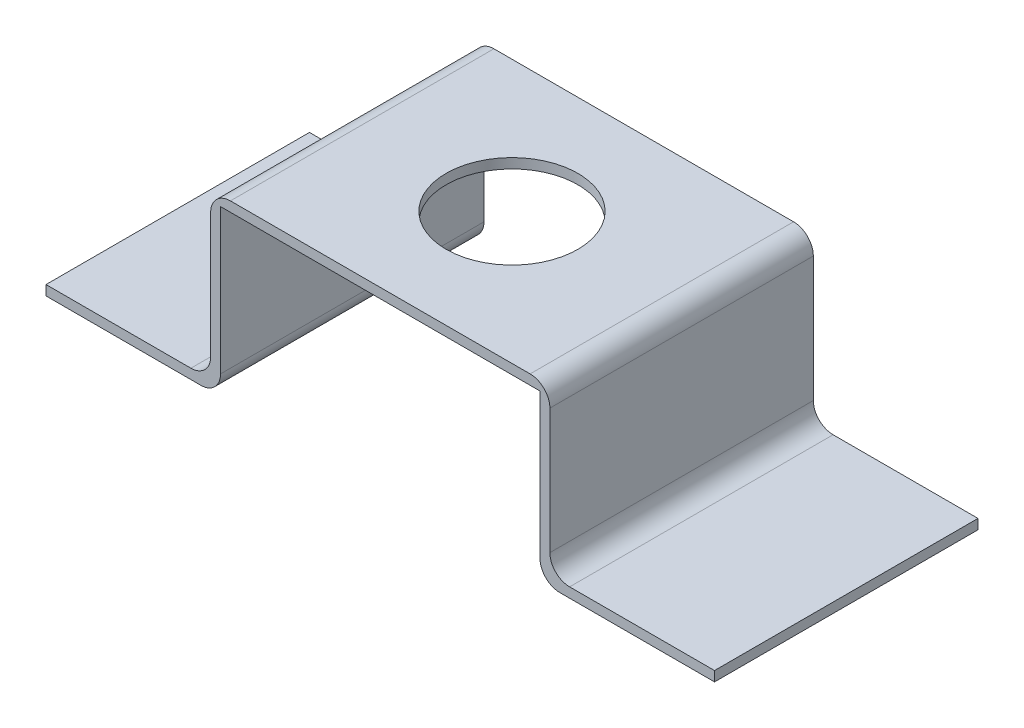
from build123d import *

# Parameters (mm, degrees)
SKETCH1_W           = 25
SKETCH1_H           = 40
BOSS_EXTRUDE1_DEPTH = 1.5
SKETCH5_W           = 40
SKETCH5_H           = 25
BOSS_EXTRUDE3_DEPTH = 1.5
SKETCH6_W           = 50
SKETCH6_H           = 40
BOSS_EXTRUDE4_DEPTH = 1.5
SKETCH7_W           = 40
SKETCH7_H           = 26.5
BOSS_EXTRUDE5_DEPTH = 1.5
SKETCH9_W           = 25
SKETCH9_H           = 40
BOSS_EXTRUDE6_DEPTH = 1.5
FILLET2_R           = 3
SKETCH10_R          = 10
CUT_EXTRUDE1_DEPTH  = 1.5
FILLET3_R           = 3


with BuildPart() as part:
    # Sketch1 → Boss-Extrude1 (new body)
    with BuildSketch(Plane(origin=(0, 0, 0), x_dir=(1, 0, 0), z_dir=(0, 1, 0))):
        Rectangle(SKETCH1_W, SKETCH1_H)
    extrude(amount=BOSS_EXTRUDE1_DEPTH)

    # Sketch5 → Boss-Extrude3 (add)
    with BuildSketch(Plane(origin=(12.5, 0, 0), x_dir=(0, 0, -1), z_dir=(1, 0, 0))):
        with Locations((0, 12.5)):
            Rectangle(SKETCH5_W, SKETCH5_H)
    extrude(amount=BOSS_EXTRUDE3_DEPTH)

    # Sketch6 → Boss-Extrude4 (add)
    with BuildSketch(Plane(origin=(0, 25, 0), x_dir=(1, 0, 0), z_dir=(0, 1, 0))):
        with Locations((37.5, 0)):
            Rectangle(SKETCH6_W, SKETCH6_H)
    extrude(amount=BOSS_EXTRUDE4_DEPTH)

    # Sketch7 → Boss-Extrude5 (add)
    with BuildSketch(Plane(origin=(62.5, 0, 0), x_dir=(0, 0, -1), z_dir=(1, 0, 0))):
        with Locations((0, 13.25)):
            Rectangle(SKETCH7_W, SKETCH7_H)
    extrude(amount=BOSS_EXTRUDE5_DEPTH)

    # Sketch9 → Boss-Extrude6 (add)
    with BuildSketch(Plane(origin=(0, 0, 0), x_dir=(1, 0, 0), z_dir=(0, 1, 0))):
        with Locations((76.5, 0)):
            Rectangle(SKETCH9_W, SKETCH9_H)
    extrude(amount=BOSS_EXTRUDE6_DEPTH)

    # Fillet2
    fillet2_edges = [part.edges().sort_by_distance(p)[0] for p in [
        (14, 0, 0),
        (12.5, 26.5, 0),
        (62.5, 0, 0),
        (64, 26.5, 0),
    ]]
    fillet(fillet2_edges, radius=FILLET2_R)

    # Sketch10 → Cut-Extrude1 (cut)
    with BuildSketch(Plane(origin=(0, 26.5, 0), x_dir=(1, 0, 0), z_dir=(0, 1, 0))):
        with Locations(Location((38.25, 0, 0), (0, 0, 270))):
            Circle(SKETCH10_R)
    extrude(amount=-CUT_EXTRUDE1_DEPTH, mode=Mode.SUBTRACT)

    # Fillet3
    fillet3_edges = [part.edges().sort_by_distance(p)[0] for p in [
        (12.5, 1.5, 0),
        (64, 1.5, 0),
    ]]
    fillet(fillet3_edges, radius=FILLET3_R)


solid = part.part
